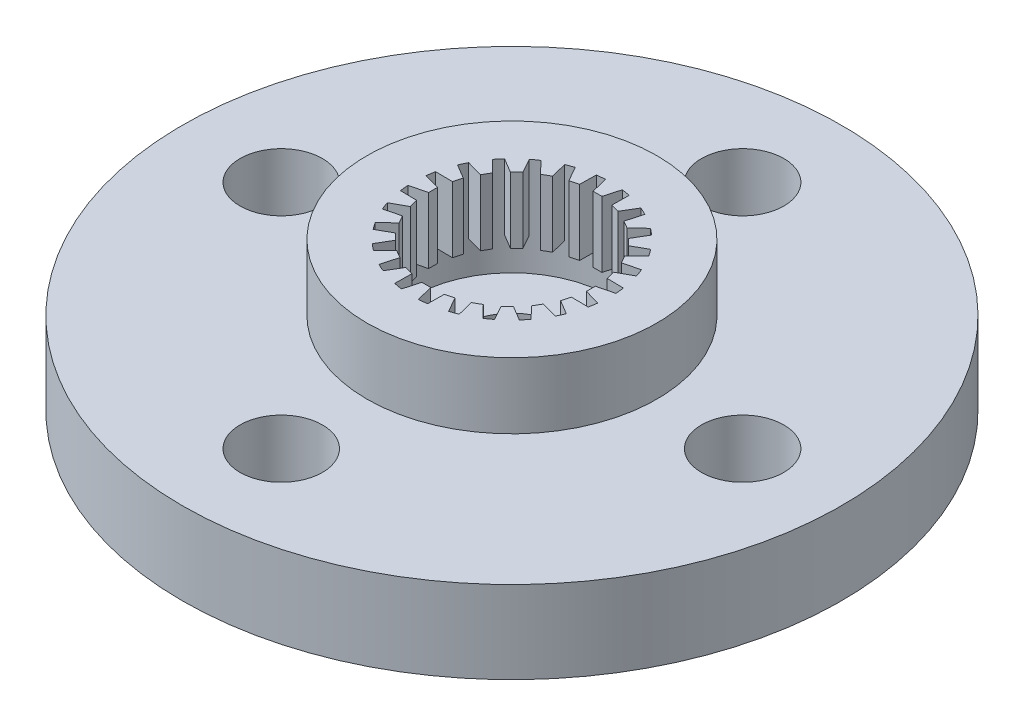
from build123d import *

# Parameters (mm, degrees)
SKETCH_4_R               = 10
EXTRUDE_2_DEPTH          = 2.5
SKETCH_7_R               = 4.4
EXTRUDE_3_DEPTH          = 2
SKETCH_8_R               = 3
CUT_EXTRUDE_10_DEPTH     = 3
EXTRUDE_5_DEPTH          = 2
PATTERN_CIRCULAR_1_COUNT = 24
HOLE_WIZARD_M3_1_D       = 2.5
CUT_EXTRUDE_11_REACH     = 16.841
SKETCH_18_R              = 1.5


with BuildPart() as part:
    # 草图4 → 凸台-拉伸2 (new body)
    with BuildSketch(Plane(origin=(0, 0, 0), x_dir=(1, 0, 0), z_dir=(0, 1, 0))):
        Circle(SKETCH_4_R)
    extrude(amount=EXTRUDE_2_DEPTH)

    # 草图7 → 凸台-拉伸3 (add)
    with BuildSketch(Plane(origin=(0, 2.5, 0), x_dir=(1, 0, 0), z_dir=(0, 1, 0))):
        Circle(SKETCH_7_R)
    extrude(amount=EXTRUDE_3_DEPTH)

    # 草图8 → 切除-拉伸10 (cut)
    with BuildSketch(Plane(origin=(0, 4.5, 0), x_dir=(1, 0, 0), z_dir=(0, 1, 0))):
        Circle(SKETCH_8_R)
    extrude(amount=-CUT_EXTRUDE_10_DEPTH, mode=Mode.SUBTRACT)

    # 草图14 → 凸台-拉伸5 (add)
    with BuildSketch(Plane(origin=(0, 4.5, 0), x_dir=(1, 0, 0), z_dir=(0, 1, 0))):
        with BuildLine():
            Line((2.976910005, -0.371492698), (2.495792863, -0.23538136))
            Line((2.495792863, -0.23538136), (2.495792863, 0.032272898))
            Line((2.495792863, 0.032272898), (2.995792863, 0.158824181))
            ThreePointArc((2.995792863, 0.158824181), (2.998100046, -0.106752588), (2.976910005, -0.371492698))
        make_face()
    extrude_5 = extrude(amount=-EXTRUDE_5_DEPTH)

    # 阵列(圆周)1: 凸台-拉伸5 ×24 about axis
    pattern_circular_1_axis = Axis((0, 4.5, 0), (0, 1, 0))
    for i in range(1, PATTERN_CIRCULAR_1_COUNT):
        add(extrude_5.rotate(pattern_circular_1_axis, i * 360 / PATTERN_CIRCULAR_1_COUNT))

    # M3 螺纹孔1 (through all)
    with Locations(Plane(origin=(0, 0, 0), x_dir=(-1, 0, 0), z_dir=(0, -1, 0))):
        with Locations((0, -7), (7, 0), (0, 7), (-7, 0)):
            Hole(HOLE_WIZARD_M3_1_D / 2)

    # 草图18 → 切除-拉伸11 (cut, up to next)
    with BuildSketch(Plane.XZ, mode=Mode.PRIVATE) as cut_extrude_11_sk1:
        Circle(SKETCH_18_R)
    cut_extrude_11_tool1 = extrude(cut_extrude_11_sk1.sketch, amount=-CUT_EXTRUDE_11_REACH, mode=Mode.PRIVATE) & part.part
    add(cut_extrude_11_tool1.solids().sort_by_distance((0, 0, 0))[0], mode=Mode.SUBTRACT)


solid = part.part
